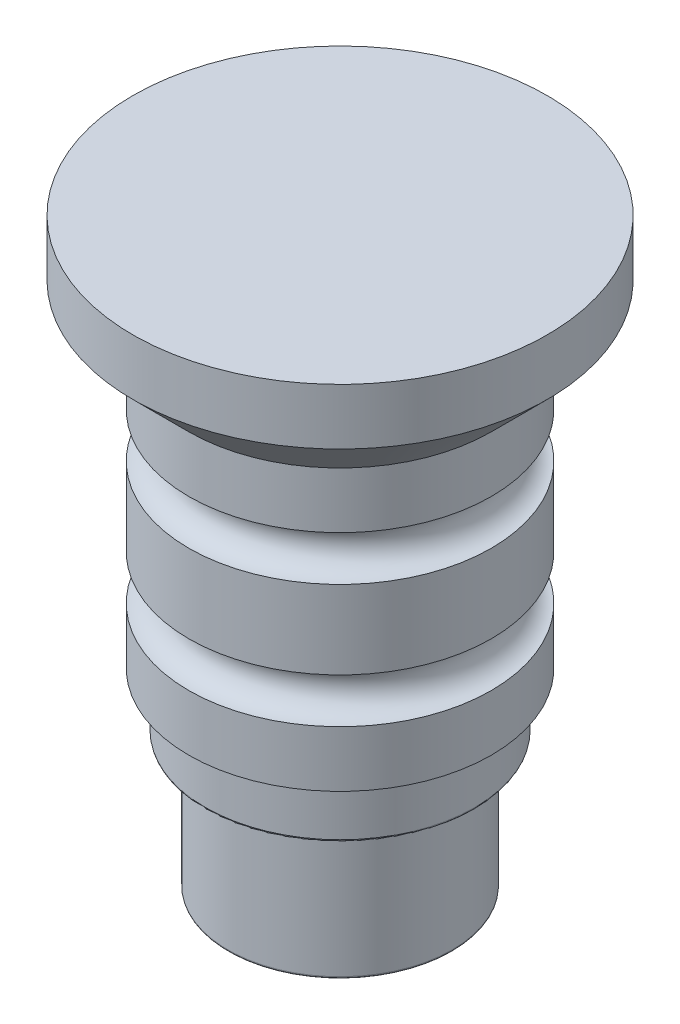
from build123d import *

# Parameters (mm, degrees)
CONG_3_R = 0.2


with BuildPart() as part:
    # Esquisse1 → Révolution1 (revolve)
    with BuildSketch(Plane.XY):
        with BuildLine():
            Line((0, 0), (-7.5, 0))
            Line((-7.5, 0), (-10, 0))
            Line((-10, 0), (-10, 12))
            Line((-10, 12), (-12, 12))
            Line((-12, 12), (-12, 17))
            Line((-12, 17), (-13.5, 17))
            Line((-13.5, 17), (-13.5, 22))
            ThreePointArc((-13.5, 22), (-11.5, 24), (-13.5, 26))
            Line((-13.5, 26), (-13.5, 33))
            ThreePointArc((-13.5, 33), (-11.5, 35), (-13.5, 37))
            Line((-13.5, 37), (-13.5, 42))
            Line((-13.5, 42), (-18.5, 47))
            Line((-18.5, 47), (-18.5, 52))
            Line((-18.5, 52), (0, 52))
            Line((0, 52), (0, 42))
            Line((0, 42), (0, 0))
        make_face()
    revolve(axis=Axis((0, 42, 0), (0, -1, 0)))

    # Congé3
    cong_3_edges = [part.edges().sort_by_distance(p)[0] for p in [
        (12, 12, 0),
        (10, 12, 0),
        (10, 0, 0),
    ]]
    fillet(cong_3_edges, radius=CONG_3_R)


solid = part.part
